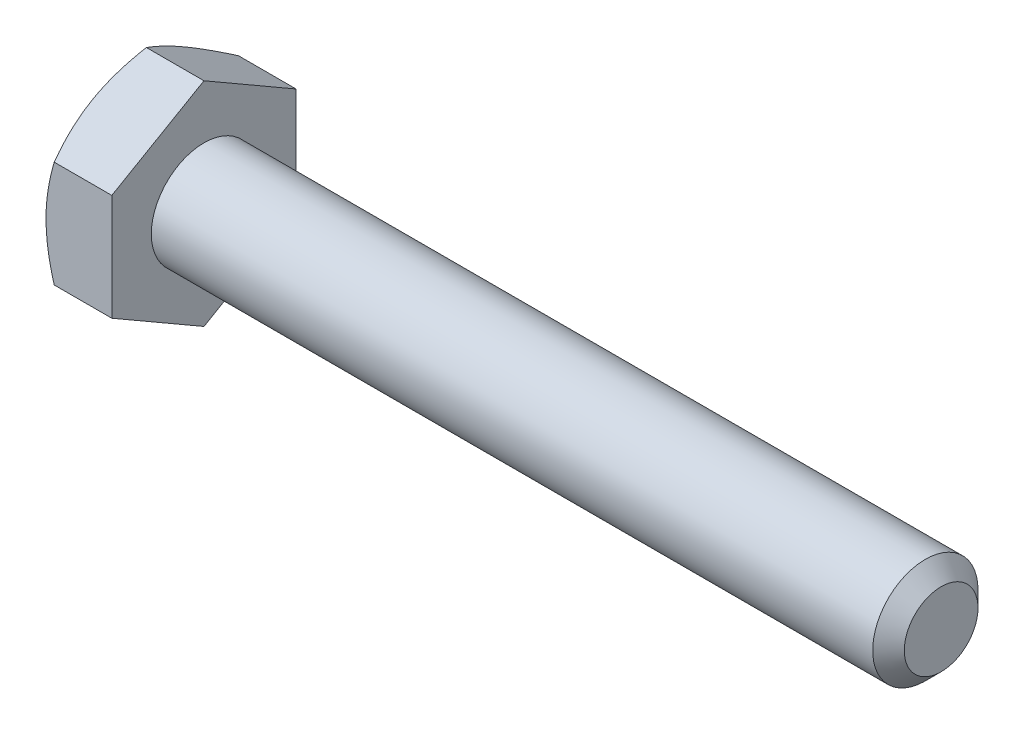
from build123d import *

# Parameters (mm, degrees)
SKETCH5_R           = 3.175
BOSS_EXTRUDE3_DEPTH = 44.45
CHAMFER1_SIZE       = 0.9525
BOSS_EXTRUDE4_DEPTH = 3.96875
SKETCH8_OUTSIDE_W   = 197.122
SKETCH8_OUTSIDE_H   = 198.842
SKETCH8_OUTSIDE_R   = 5.55625
CUT_EXTRUDE3_DEPTH  = 50.156991545
CUT_EXTRUDE3_DRAFT  = -60


with BuildPart() as part:
    # Sketch5 → Boss-Extrude3 (new body)
    with BuildSketch(Plane(origin=(24.209375, 0, 0), x_dir=(0, 0, -1), z_dir=(1, 0, 0))):
        Circle(SKETCH5_R)
    extrude(amount=-BOSS_EXTRUDE3_DEPTH)

    # Chamfer1
    chamfer1_edges = [part.edges().sort_by_distance(p)[0] for p in [
        (24.209375, 0, 3.175),
    ]]
    chamfer(chamfer1_edges, length=CHAMFER1_SIZE)

    # Sketch6 → Boss-Extrude4 (add)
    with BuildSketch(Plane.ZY.offset(20.240625)):
        Polygon((5.55625, 3.207902433), (0, 6.415804866), (-5.55625, 3.207902433), (-5.55625, -3.207902433), (0, -6.415804866), (5.55625, -3.207902433), align=None)
    extrude(amount=BOSS_EXTRUDE4_DEPTH)


with BuildPart() as cut_extrude3_tool:
    # Sketch8 outside → Cut-Extrude3 (with draft: the straight prism first)
    with BuildSketch(Plane.ZY.offset(24.209375)):
        Rectangle(SKETCH8_OUTSIDE_W, SKETCH8_OUTSIDE_H)
        Circle(SKETCH8_OUTSIDE_R, mode=Mode.SUBTRACT)
    extrude(amount=-CUT_EXTRUDE3_DEPTH)
    # Cut-Extrude3: the draft: its side faces are tilted about the plane it starts from
    cut_extrude3_sides = [cut_extrude3_tool.faces().sort_by_distance(p)[0] for p in [
        (0.869120772, -99.421, 0),
        (0.869120772, 0, 98.561),
        (0.869120772, 99.421, 0),
        (0.869120772, 0, -98.561),
        (0.869120772, 0, -5.55625),
    ]]
    draft(cut_extrude3_sides, Plane.ZY.offset(24.209375), CUT_EXTRUDE3_DRAFT)


with BuildPart() as part_1:
    add(part.part)

    # Cut-Extrude3: cut by cut_extrude3_tool
    add(cut_extrude3_tool.part, mode=Mode.SUBTRACT)


solid = part_1.part
